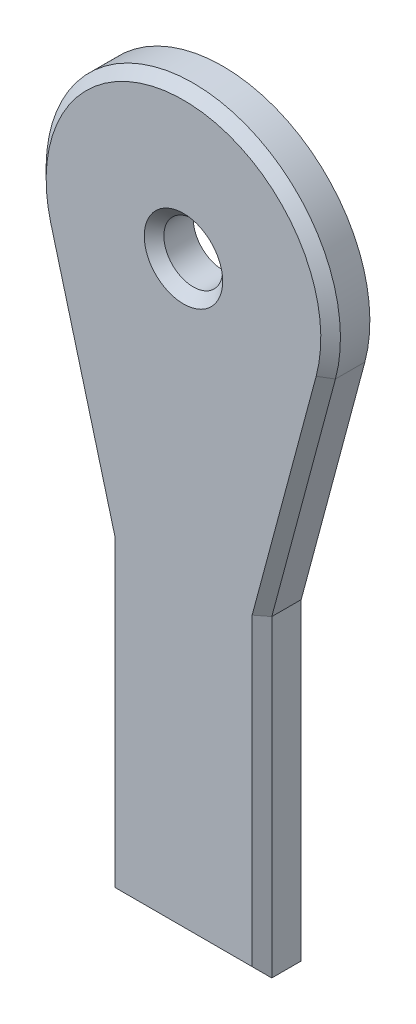
from build123d import *

# Parameters (mm, degrees)
SKETCH1_R           = 7.5
BOSS_EXTRUDE1_DEPTH = 10
CHAMFER1_SIZE       = 2.5


with BuildPart() as part:
    # Sketch1 → Boss-Extrude1 (new body)
    with BuildSketch(Plane.XY):
        with BuildLine():
            Line((36.222218486, -9.705714191), (20, -70.247857792))
            Line((20, -70.247857792), (20, -150))
            Line((20, -150), (-20, -150))
            Line((-20, -150), (-20, -70.247857792))
            Line((-20, -70.247857792), (-36.222218486, -9.705714191))
            ThreePointArc((-36.222218486, -9.705714191), (0, 37.5), (36.222218486, -9.705714191))
        make_face()
        Circle(SKETCH1_R, mode=Mode.SUBTRACT)
    extrude(amount=BOSS_EXTRUDE1_DEPTH)

    # Chamfer1
    chamfer1_edges = [part.edges().sort_by_distance(p)[0] for p in [
        (-20, -110.123928896, 10),
        (0, -150, 10),
        (-7.5, 0, 10),
        (20, -110.123928896, 10),
        (28.111109243, -39.976785992, 10),
        (0, 37.5, 10),
        (-28.111109243, -39.976785992, 10),
    ]]
    chamfer(chamfer1_edges, length=CHAMFER1_SIZE)


solid = part.part
